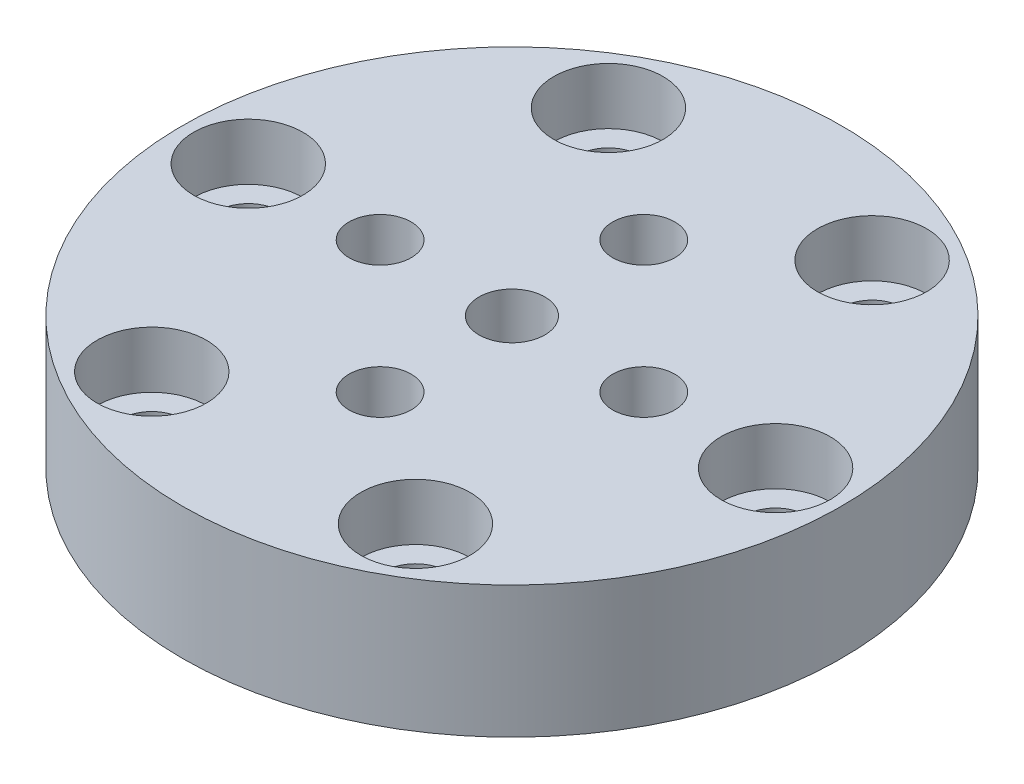
from build123d import *

# Parameters (mm, degrees)
SKETCH_1_R          = 17.5
SKETCH_1_R_2        = 1.65
SKETCH_1_R_3        = 1.75
EXTRUDE_1_DEPTH     = 7
SKETCH_2_R          = 2.9
CUT_EXTRUDE_1_DEPTH = 3


with BuildPart() as part:
    # 草图1 → 凸台-拉伸1 (new body)
    with BuildSketch(Plane(origin=(0, 0, 0), x_dir=(1, 0, 0), z_dir=(0, 1, 0))):
        with Locations(Location((0, 0, 0), (0, 0, 270))):
            Circle(SKETCH_1_R)
        with Locations(Location((-14, 0, 0), (0, 0, 270))):
            Circle(SKETCH_1_R_2, mode=Mode.SUBTRACT)
        with Locations(Location((-7, 12.124355653, 0), (0, 0, 270))):
            Circle(SKETCH_1_R_2, mode=Mode.SUBTRACT)
        with Locations(Location((7, 12.124355653, 0), (0, 0, 270))):
            Circle(SKETCH_1_R_2, mode=Mode.SUBTRACT)
        with Locations(Location((14, 0, 0), (0, 0, 270))):
            Circle(SKETCH_1_R_2, mode=Mode.SUBTRACT)
        with Locations(Location((7, -12.124355653, 0), (0, 0, 270))):
            Circle(SKETCH_1_R_2, mode=Mode.SUBTRACT)
        with Locations(Location((-7, -12.124355653, 0), (0, 0, 270))):
            Circle(SKETCH_1_R_2, mode=Mode.SUBTRACT)
        with Locations(Location((0, 0, 0), (0, 0, 270))):
            Circle(SKETCH_1_R_3, mode=Mode.SUBTRACT)
        with Locations(Location((7, 0, 0), (0, 0, 270))):
            Circle(SKETCH_1_R_2, mode=Mode.SUBTRACT)
        with Locations(Location((0, -7, 0), (0, 0, 270))):
            Circle(SKETCH_1_R_2, mode=Mode.SUBTRACT)
        with Locations(Location((-7, 0, 0), (0, 0, 270))):
            Circle(SKETCH_1_R_2, mode=Mode.SUBTRACT)
        with Locations(Location((0, 7, 0), (0, 0, 270))):
            Circle(SKETCH_1_R_2, mode=Mode.SUBTRACT)
    extrude(amount=EXTRUDE_1_DEPTH)

    # 草图2 → 切除-拉伸1 (cut)
    with BuildSketch(Plane(origin=(0, 7, 0), x_dir=(1, 0, 0), z_dir=(0, 1, 0))):
        with Locations(Location((-14, 0, 0), (0, 0, 270))):
            Circle(SKETCH_2_R)
        with Locations(Location((-7, 12.124355653, 0), (0, 0, 270))):
            Circle(SKETCH_2_R)
        with Locations(Location((7, 12.124355653, 0), (0, 0, 270))):
            Circle(SKETCH_2_R)
        with Locations(Location((14, 0, 0), (0, 0, 270))):
            Circle(SKETCH_2_R)
        with Locations(Location((7, -12.124355653, 0), (0, 0, 270))):
            Circle(SKETCH_2_R)
        with Locations(Location((-7, -12.124355653, 0), (0, 0, 270))):
            Circle(SKETCH_2_R)
    extrude(amount=-CUT_EXTRUDE_1_DEPTH, mode=Mode.SUBTRACT)


solid = part.part
